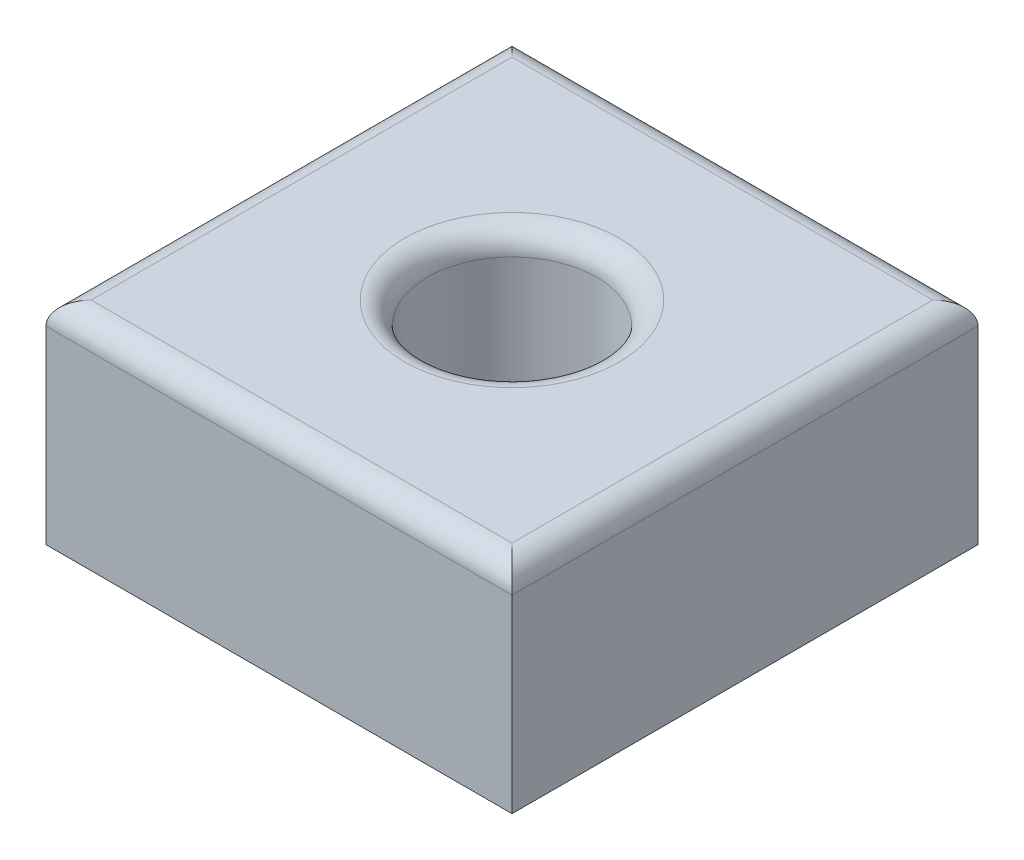
from build123d import *

# Parameters (mm, degrees)
SKETCH1_W           = 52.3875
SKETCH1_H           = 52.3875
SKETCH1_R           = 9.525
BOSS_EXTRUDE1_DEPTH = 23.8125
FILLET1_R           = 2.54


with BuildPart() as part:
    # Sketch1 → Boss-Extrude1 (new body)
    with BuildSketch(Plane(origin=(0, 0, 0), x_dir=(1, 0, 0), z_dir=(0, 1, 0))):
        Rectangle(SKETCH1_W, SKETCH1_H)
        with Locations(Location((0, 0, 0), (0, 0, 270))):
            Circle(SKETCH1_R, mode=Mode.SUBTRACT)
    extrude(amount=BOSS_EXTRUDE1_DEPTH)

    # Fillet1
    fillet1_edges = [part.edges().sort_by_distance(p)[0] for p in [
        (26.19375, 23.8125, 0),
        (0, 23.8125, -9.525),
        (0, 23.8125, -26.19375),
        (-26.19375, 23.8125, 0),
        (0, 23.8125, 26.19375),
    ]]
    fillet(fillet1_edges, radius=FILLET1_R)


solid = part.part
